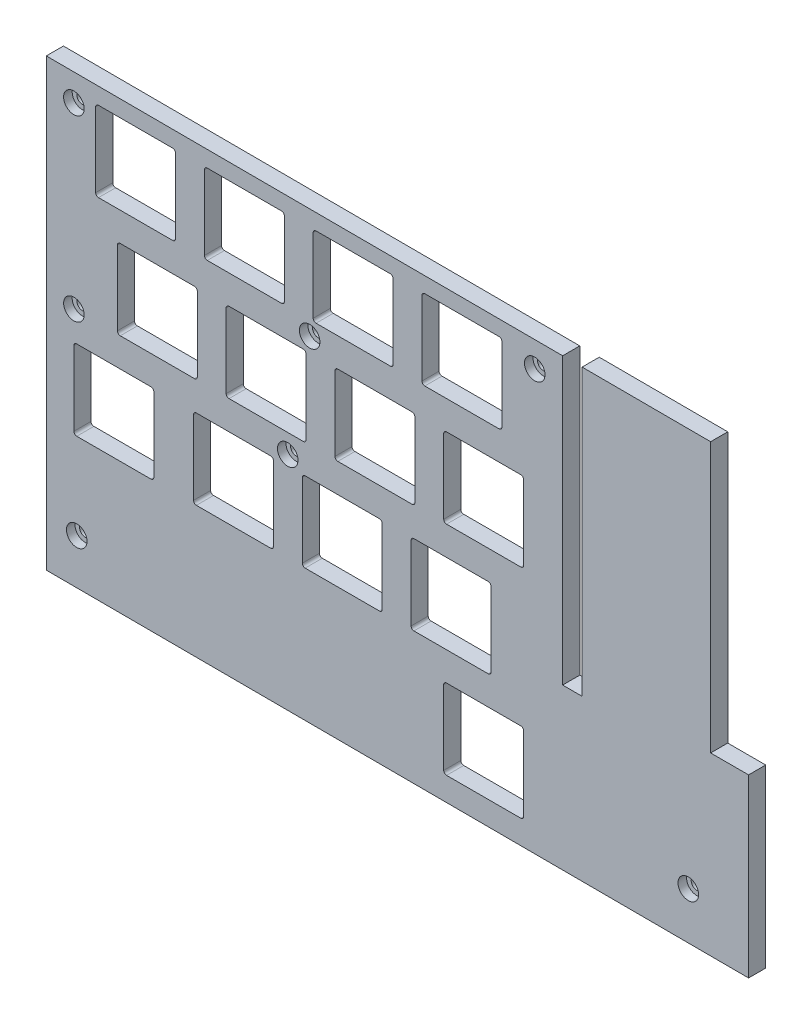
from build123d import *

# Parameters (mm, degrees)
MODEL_R             = 1
BOSS_EXTRUDE1_DEPTH = 3
CUT_EXTRUDE1_START  = 3
MODEL_3_R           = 1.8
CUT_EXTRUDE1_DEPTH  = 1.5
SKETCH3_W           = 3.410478587
SKETCH3_H           = 49.945504098
SKETCH3_W_2         = 6.648180457
SKETCH3_H_2         = 47.210710856
CUT_EXTRUDE2_DEPTH  = 5
SKETCH4_R           = 3.544423748
SKETCH4_R_2         = 2.369129831
BOSS_EXTRUDE2_DEPTH = 7


with BuildPart() as part:
    # Model → Boss-Extrude1 (new body)
    with BuildSketch(Plane.XY):
        Polygon((0, -78), (123, -78.361463573), (123, -0.361463573), (0, 0), align=None)
        with Locations((4.834975253, -4.704019458)):
            Circle(MODEL_R, mode=Mode.SUBTRACT)
        with Locations((46.124975253, -19.448037489)):
            Circle(MODEL_R, mode=Mode.SUBTRACT)
        with Locations((42.286307754, -39.29983525)):
            Circle(MODEL_R, mode=Mode.SUBTRACT)
        with Locations((4.834975253, -35.973037489)):
            Circle(MODEL_R, mode=Mode.SUBTRACT)
        with Locations((85.542975253, -4.704019458)):
            Circle(MODEL_R, mode=Mode.SUBTRACT)
        with Locations((5.334975253, -70.100370509)):
            Circle(MODEL_R, mode=Mode.SUBTRACT)
        with Locations((112.441999555, -70.100370509)):
            Circle(MODEL_R, mode=Mode.SUBTRACT)
        with BuildLine():
            Line((9.144975253, -2.923037489), (22.144975253, -2.923037489))
            ThreePointArc((22.144975253, -2.923037489), (22.498528643, -3.069484099), (22.644975253, -3.423037489))
            Line((22.644975253, -3.423037489), (22.644975253, -16.423037489))
            ThreePointArc((22.644975253, -16.423037489), (22.498528643, -16.77659088), (22.144975253, -16.923037489))
            Line((22.144975253, -16.923037489), (9.144975253, -16.923037489))
            ThreePointArc((9.144975253, -16.923037489), (8.791421862, -16.77659088), (8.644975253, -16.423037489))
            Line((8.644975253, -16.423037489), (8.644975253, -3.423037489))
            ThreePointArc((8.644975253, -3.423037489), (8.791421862, -3.069484099), (9.144975253, -2.923037489))
        make_face(mode=Mode.SUBTRACT)
        with BuildLine():
            Line((28.194975253, -2.923037489), (41.194975253, -2.923037489))
            ThreePointArc((41.194975253, -2.923037489), (41.548528643, -3.069484099), (41.694975253, -3.423037489))
            Line((41.694975253, -3.423037489), (41.694975253, -16.423037489))
            ThreePointArc((41.694975253, -16.423037489), (41.548528643, -16.77659088), (41.194975253, -16.923037489))
            Line((41.194975253, -16.923037489), (28.194975253, -16.923037489))
            ThreePointArc((28.194975253, -16.923037489), (27.841421862, -16.77659088), (27.694975253, -16.423037489))
            Line((27.694975253, -16.423037489), (27.694975253, -3.423037489))
            ThreePointArc((27.694975253, -3.423037489), (27.841421862, -3.069484099), (28.194975253, -2.923037489))
        make_face(mode=Mode.SUBTRACT)
        with BuildLine():
            Line((47.244975253, -2.923037489), (60.244975253, -2.923037489))
            ThreePointArc((60.244975253, -2.923037489), (60.598528643, -3.069484099), (60.744975253, -3.423037489))
            Line((60.744975253, -3.423037489), (60.744975253, -16.423037489))
            ThreePointArc((60.744975253, -16.423037489), (60.598528643, -16.77659088), (60.244975253, -16.923037489))
            Line((60.244975253, -16.923037489), (47.244975253, -16.923037489))
            ThreePointArc((47.244975253, -16.923037489), (46.891421862, -16.77659088), (46.744975253, -16.423037489))
            Line((46.744975253, -16.423037489), (46.744975253, -3.423037489))
            ThreePointArc((46.744975253, -3.423037489), (46.891421862, -3.069484099), (47.244975253, -2.923037489))
        make_face(mode=Mode.SUBTRACT)
        with BuildLine():
            Line((66.294975253, -2.923037489), (79.294975253, -2.923037489))
            ThreePointArc((79.294975253, -2.923037489), (79.648528643, -3.069484099), (79.794975253, -3.423037489))
            Line((79.794975253, -3.423037489), (79.794975253, -16.423037489))
            ThreePointArc((79.794975253, -16.423037489), (79.648528643, -16.77659088), (79.294975253, -16.923037489))
            Line((79.294975253, -16.923037489), (66.294975253, -16.923037489))
            ThreePointArc((66.294975253, -16.923037489), (65.941421862, -16.77659088), (65.794975253, -16.423037489))
            Line((65.794975253, -16.423037489), (65.794975253, -3.423037489))
            ThreePointArc((65.794975253, -3.423037489), (65.941421862, -3.069484099), (66.294975253, -2.923037489))
        make_face(mode=Mode.SUBTRACT)
        with BuildLine():
            Line((12.954975253, -21.973037489), (25.954975253, -21.973037489))
            ThreePointArc((25.954975253, -21.973037489), (26.308528643, -22.119484099), (26.454975253, -22.473037489))
            Line((26.454975253, -22.473037489), (26.454975253, -35.473037489))
            ThreePointArc((26.454975253, -35.473037489), (26.308528643, -35.82659088), (25.954975253, -35.973037489))
            Line((25.954975253, -35.973037489), (12.954975253, -35.973037489))
            ThreePointArc((12.954975253, -35.973037489), (12.601421862, -35.82659088), (12.454975253, -35.473037489))
            Line((12.454975253, -35.473037489), (12.454975253, -22.473037489))
            ThreePointArc((12.454975253, -22.473037489), (12.601421862, -22.119484099), (12.954975253, -21.973037489))
        make_face(mode=Mode.SUBTRACT)
        with BuildLine():
            Line((32.004975253, -21.973037489), (45.004975253, -21.973037489))
            ThreePointArc((45.004975253, -21.973037489), (45.358528643, -22.119484099), (45.504975253, -22.473037489))
            Line((45.504975253, -22.473037489), (45.504975253, -35.473037489))
            ThreePointArc((45.504975253, -35.473037489), (45.358528643, -35.82659088), (45.004975253, -35.973037489))
            Line((45.004975253, -35.973037489), (32.004975253, -35.973037489))
            ThreePointArc((32.004975253, -35.973037489), (31.651421862, -35.82659088), (31.504975253, -35.473037489))
            Line((31.504975253, -35.473037489), (31.504975253, -22.473037489))
            ThreePointArc((31.504975253, -22.473037489), (31.651421862, -22.119484099), (32.004975253, -21.973037489))
        make_face(mode=Mode.SUBTRACT)
        with BuildLine():
            Line((51.054975253, -21.973037489), (64.054975253, -21.973037489))
            ThreePointArc((64.054975253, -21.973037489), (64.408528643, -22.119484099), (64.554975253, -22.473037489))
            Line((64.554975253, -22.473037489), (64.554975253, -35.473037489))
            ThreePointArc((64.554975253, -35.473037489), (64.408528643, -35.82659088), (64.054975253, -35.973037489))
            Line((64.054975253, -35.973037489), (51.054975253, -35.973037489))
            ThreePointArc((51.054975253, -35.973037489), (50.701421862, -35.82659088), (50.554975253, -35.473037489))
            Line((50.554975253, -35.473037489), (50.554975253, -22.473037489))
            ThreePointArc((50.554975253, -22.473037489), (50.701421862, -22.119484099), (51.054975253, -21.973037489))
        make_face(mode=Mode.SUBTRACT)
        with BuildLine():
            Line((70.104975253, -21.973037489), (83.104975253, -21.973037489))
            ThreePointArc((83.104975253, -21.973037489), (83.458528643, -22.119484099), (83.604975253, -22.473037489))
            Line((83.604975253, -22.473037489), (83.604975253, -35.473037489))
            ThreePointArc((83.604975253, -35.473037489), (83.458528643, -35.82659088), (83.104975253, -35.973037489))
            Line((83.104975253, -35.973037489), (70.104975253, -35.973037489))
            ThreePointArc((70.104975253, -35.973037489), (69.751421862, -35.82659088), (69.604975253, -35.473037489))
            Line((69.604975253, -35.473037489), (69.604975253, -22.473037489))
            ThreePointArc((69.604975253, -22.473037489), (69.751421862, -22.119484099), (70.104975253, -21.973037489))
        make_face(mode=Mode.SUBTRACT)
        with BuildLine():
            Line((5.334975253, -41.023037489), (18.334975253, -41.023037489))
            ThreePointArc((18.334975253, -41.023037489), (18.688528643, -41.169484099), (18.834975253, -41.523037489))
            Line((18.834975253, -41.523037489), (18.834975253, -54.523037489))
            ThreePointArc((18.834975253, -54.523037489), (18.688528643, -54.87659088), (18.334975253, -55.023037489))
            Line((18.334975253, -55.023037489), (5.334975253, -55.023037489))
            ThreePointArc((5.334975253, -55.023037489), (4.981421862, -54.87659088), (4.834975253, -54.523037489))
            Line((4.834975253, -54.523037489), (4.834975253, -41.523037489))
            ThreePointArc((4.834975253, -41.523037489), (4.981421862, -41.169484099), (5.334975253, -41.023037489))
        make_face(mode=Mode.SUBTRACT)
        with BuildLine():
            Line((26.289975253, -41.023037489), (39.289975253, -41.023037489))
            ThreePointArc((39.289975253, -41.023037489), (39.643528643, -41.169484099), (39.789975253, -41.523037489))
            Line((39.789975253, -41.523037489), (39.789975253, -54.523037489))
            ThreePointArc((39.789975253, -54.523037489), (39.643528643, -54.87659088), (39.289975253, -55.023037489))
            Line((39.289975253, -55.023037489), (26.289975253, -55.023037489))
            ThreePointArc((26.289975253, -55.023037489), (25.936421862, -54.87659088), (25.789975253, -54.523037489))
            Line((25.789975253, -54.523037489), (25.789975253, -41.523037489))
            ThreePointArc((25.789975253, -41.523037489), (25.936421862, -41.169484099), (26.289975253, -41.023037489))
        make_face(mode=Mode.SUBTRACT)
        with BuildLine():
            Line((45.339975253, -41.023037489), (58.339975253, -41.023037489))
            ThreePointArc((58.339975253, -41.023037489), (58.693528643, -41.169484099), (58.839975253, -41.523037489))
            Line((58.839975253, -41.523037489), (58.839975253, -54.523037489))
            ThreePointArc((58.839975253, -54.523037489), (58.693528643, -54.87659088), (58.339975253, -55.023037489))
            Line((58.339975253, -55.023037489), (45.339975253, -55.023037489))
            ThreePointArc((45.339975253, -55.023037489), (44.986421862, -54.87659088), (44.839975253, -54.523037489))
            Line((44.839975253, -54.523037489), (44.839975253, -41.523037489))
            ThreePointArc((44.839975253, -41.523037489), (44.986421862, -41.169484099), (45.339975253, -41.023037489))
        make_face(mode=Mode.SUBTRACT)
        with BuildLine():
            Line((64.389975253, -41.023037489), (77.389975253, -41.023037489))
            ThreePointArc((77.389975253, -41.023037489), (77.743528643, -41.169484099), (77.889975253, -41.523037489))
            Line((77.889975253, -41.523037489), (77.889975253, -54.523037489))
            ThreePointArc((77.889975253, -54.523037489), (77.743528643, -54.87659088), (77.389975253, -55.023037489))
            Line((77.389975253, -55.023037489), (64.389975253, -55.023037489))
            ThreePointArc((64.389975253, -55.023037489), (64.036421862, -54.87659088), (63.889975253, -54.523037489))
            Line((63.889975253, -54.523037489), (63.889975253, -41.523037489))
            ThreePointArc((63.889975253, -41.523037489), (64.036421862, -41.169484099), (64.389975253, -41.023037489))
        make_face(mode=Mode.SUBTRACT)
        with BuildLine():
            Line((70.104975253, -60.073037489), (83.104975253, -60.073037489))
            ThreePointArc((83.104975253, -60.073037489), (83.458528643, -60.219484099), (83.604975253, -60.573037489))
            Line((83.604975253, -60.573037489), (83.604975253, -73.573037489))
            ThreePointArc((83.604975253, -73.573037489), (83.458528643, -73.92659088), (83.104975253, -74.073037489))
            Line((83.104975253, -74.073037489), (70.104975253, -74.073037489))
            ThreePointArc((70.104975253, -74.073037489), (69.751421862, -73.92659088), (69.604975253, -73.573037489))
            Line((69.604975253, -73.573037489), (69.604975253, -60.573037489))
            ThreePointArc((69.604975253, -60.573037489), (69.751421862, -60.219484099), (70.104975253, -60.073037489))
        make_face(mode=Mode.SUBTRACT)
    extrude(amount=BOSS_EXTRUDE1_DEPTH)

    # Model<3> → Cut-Extrude1 (cut)
    with BuildSketch(Plane.XY.offset(CUT_EXTRUDE1_START)):
        with Locations((85.542975253, -4.704019458)):
            Circle(MODEL_3_R)
        with Locations((4.834975253, -4.704019458)):
            Circle(MODEL_3_R)
        with Locations((46.124975253, -19.448037489)):
            Circle(MODEL_3_R)
        with Locations((42.286307754, -39.29983525)):
            Circle(MODEL_3_R)
        with Locations((4.834975253, -35.973037489)):
            Circle(MODEL_3_R)
        with Locations((5.334975253, -70.100370509)):
            Circle(MODEL_3_R)
        with Locations((112.441999555, -70.100370509)):
            Circle(MODEL_3_R)
    extrude(amount=-CUT_EXTRUDE1_DEPTH, mode=Mode.SUBTRACT)

    # Sketch3 → Cut-Extrude2 (cut)
    with BuildSketch(Plane.XY.offset(3)):
        with Locations((92.139427294, -25.238513551)):
            Rectangle(SKETCH3_W, SKETCH3_H)
        with Locations((119.675909772, -23.947281806)):
            Rectangle(SKETCH3_W_2, SKETCH3_H_2)
    extrude(amount=-CUT_EXTRUDE2_DEPTH, mode=Mode.SUBTRACT)

    # Sketch4 → Boss-Extrude2 (add)
    with BuildSketch(Plane.XY):
        with Locations((104.757578873, -16.130439743)):
            Circle(SKETCH4_R)
        with Locations((104.757578873, -16.130439743)):
            Circle(SKETCH4_R_2, mode=Mode.SUBTRACT)
    extrude(amount=-BOSS_EXTRUDE2_DEPTH)


solid = part.part
